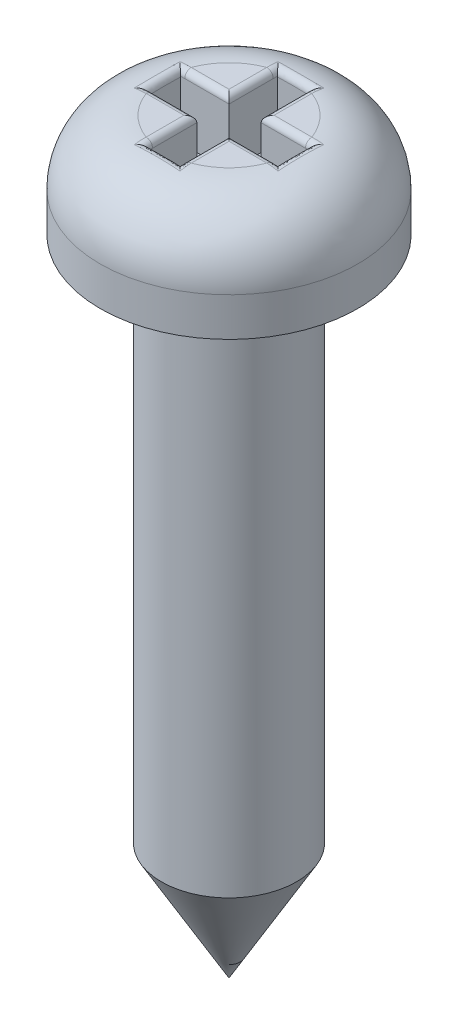
from build123d import *

# Parameters (mm, degrees)
SKETCH1_R           = 2
BOSS_EXTRUDE1_DEPTH = 0.6
SKETCH3_R           = 2
BOSS_EXTRUDE2_DEPTH = 1
FILLET1_R           = 1
CUT_EXTRUDE1_DEPTH  = 1
FILLET2_R           = 0.1
SKETCH5_R           = 1.05
BOSS_EXTRUDE3_DEPTH = 10
CHAMFER1_SIZE       = 1.05
CHAMFER1_SIZE2      = 1.818653348


with BuildPart() as part:
    # Sketch1 → Boss-Extrude1 (new body)
    with BuildSketch(Plane(origin=(0, 0, 0), x_dir=(1, 0, 0), z_dir=(0, 1, 0))):
        with Locations(Location((0, 0, 0), (0, 0, 270))):
            Circle(SKETCH1_R)
    extrude(amount=BOSS_EXTRUDE1_DEPTH)

    # Sketch3 → Boss-Extrude2 (add)
    with BuildSketch(Plane(origin=(0, 0.6, 0), x_dir=(1, 0, 0), z_dir=(0, 1, 0))):
        with Locations(Location((0, 0, 0), (0, 0, 270))):
            Circle(SKETCH3_R)
    extrude(amount=BOSS_EXTRUDE2_DEPTH)

    # Fillet1
    fillet1_edges = [part.edges().sort_by_distance(p)[0] for p in [
        (0, 1.6, -2),
    ]]
    fillet(fillet1_edges, radius=FILLET1_R)

    # Sketch4 → Cut-Extrude1 (cut)
    with BuildSketch(Plane(origin=(0, 1.6, 0), x_dir=(1, 0, 0), z_dir=(0, 1, 0))):
        Polygon((-1, -0.25), (-0.25, -0.25), (-0.25, -1), (0.25, -1), (0.25, -0.25), (1, -0.25), (1, 0.25), (0.25, 0.25), (0.25, 1), (-0.25, 1), (-0.25, 0.25), (-1, 0.25), align=None)
    extrude(amount=-CUT_EXTRUDE1_DEPTH, mode=Mode.SUBTRACT)

    # Fillet2
    fillet2_edges = [part.edges().sort_by_distance(p)[0] for p in [
        (-0.984124687, 1.599881683, 0.25),
        (-1, 1.599999802, 0),
        (-0.984124687, 1.599881683, -0.25),
        (-0.25, 1.599881683, 0.984124687),
        (0.125000499, 1.599969736, 1),
        (0.25, 1.599881683, 0.984124687),
        (0.984124687, 1.599881683, 0.25),
        (1, 1.600001046, 1.2e-08),
        (0.984124687, 1.599881683, -0.25),
        (0.25, 1.599881683, -0.984124687),
        (1.2e-08, 1.600001046, -1),
        (-0.25, 1.599881683, -0.984124687),
        (-0.609122918, 1.6, 0.25),
        (-0.25, 1.6, 0.609122918),
        (0.25, 1.6, 0.609122918),
        (0.609122918, 1.6, 0.25),
        (0.609122918, 1.6, -0.25),
        (0.25, 1.6, -0.609122918),
        (-0.25, 1.6, -0.609122918),
        (-0.609122918, 1.6, -0.25),
    ]]
    fillet(fillet2_edges, radius=FILLET2_R)

    # Sketch5 → Boss-Extrude3 (add)
    with BuildSketch(Plane.XZ):
        with Locations(Location((0, 0, 0), (0, 0, 270))):
            Circle(SKETCH5_R)
    extrude(amount=BOSS_EXTRUDE3_DEPTH)

    # Chamfer1
    chamfer1_edges = [part.edges().sort_by_distance(p)[0] for p in [
        (0, -10, 1.05),
    ]]
    chamfer1_side = [part.faces().sort_by_distance(p)[0] for p in [
        (0, -10, 0),
    ]]
    chamfer(chamfer1_edges, length=CHAMFER1_SIZE, length2=CHAMFER1_SIZE2, reference=chamfer1_side[0])


solid = part.part
